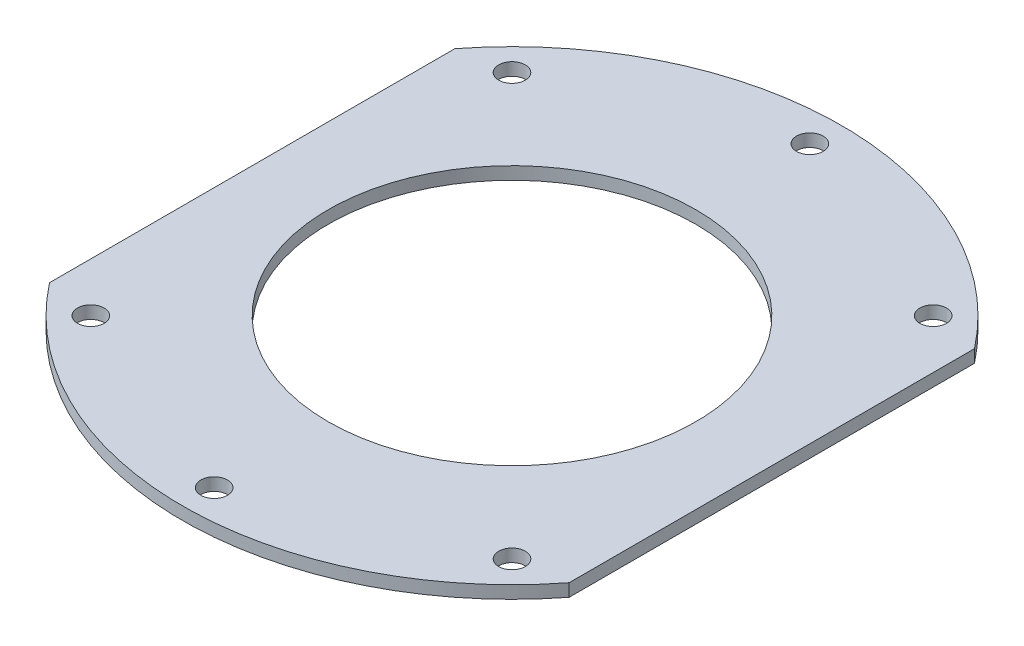
from build123d import *

# Parameters (mm, degrees)
SKETCH_1_R          = 52
SKETCH_1_R_2        = 29
SKETCH_1_R_3        = 2.1
EXTRUDE_1_DEPTH     = 2
SKETCH_2_W          = 182
SKETCH_2_H          = 210.035227354
SKETCH_2_W_2        = 82
SKETCH_2_H_2        = 110.035227354
CUT_EXTRUDE_1_DEPTH = 10


with BuildPart() as part:
    # 草图1 → 凸台-拉伸1 (new body)
    with BuildSketch(Plane(origin=(0, 0, 0), x_dir=(1, 0, 0), z_dir=(0, 1, 0))):
        with Locations(Location((0, 0, 0), (0, 0, 270))):
            Circle(SKETCH_1_R)
        with Locations(Location((0, 0, 0), (0, 0, 270))):
            Circle(SKETCH_1_R_2, mode=Mode.SUBTRACT)
        with Locations(Location((47, 0, 0), (0, 0, 270))):
            Circle(SKETCH_1_R_3, mode=Mode.SUBTRACT)
        with Locations(Location((33.234018716, -33.234018716, 0), (0, 0, 270))):
            Circle(SKETCH_1_R_3, mode=Mode.SUBTRACT)
        with Locations(Location((0, -47, 0), (0, 0, 270))):
            Circle(SKETCH_1_R_3, mode=Mode.SUBTRACT)
        with Locations(Location((-33.234018716, -33.234018716, 0), (0, 0, 270))):
            Circle(SKETCH_1_R_3, mode=Mode.SUBTRACT)
        with Locations(Location((-47, 0, 0), (0, 0, 270))):
            Circle(SKETCH_1_R_3, mode=Mode.SUBTRACT)
        with Locations(Location((-33.234018716, 33.234018716, 0), (0, 0, 270))):
            Circle(SKETCH_1_R_3, mode=Mode.SUBTRACT)
        with Locations(Location((0, 47, 0), (0, 0, 270))):
            Circle(SKETCH_1_R_3, mode=Mode.SUBTRACT)
        with Locations(Location((33.234018716, 33.234018716, 0), (0, 0, 270))):
            Circle(SKETCH_1_R_3, mode=Mode.SUBTRACT)
    extrude(amount=EXTRUDE_1_DEPTH)

    # 草图2 → 切除-拉伸-薄壁1 (cut)
    with BuildSketch(Plane(origin=(0, 2, 0), x_dir=(1, 0, 0), z_dir=(0, 1, 0))):
        Rectangle(SKETCH_2_W, SKETCH_2_H)
        Rectangle(SKETCH_2_W_2, SKETCH_2_H_2, mode=Mode.SUBTRACT)
    extrude(amount=-CUT_EXTRUDE_1_DEPTH, mode=Mode.SUBTRACT)


solid = part.part
